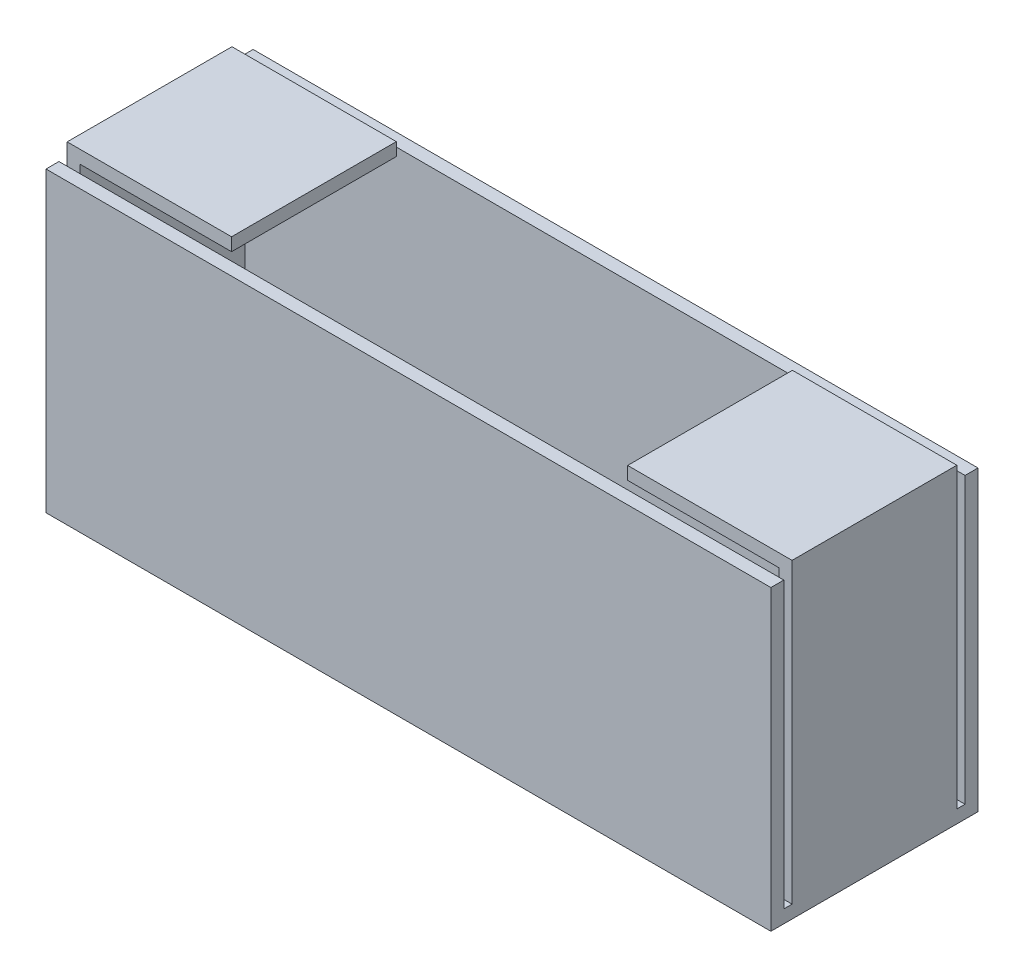
from build123d import *

# Parameters (mm, degrees)
SKETCH1_W           = 56
SKETCH1_H           = 16
BOSS_EXTRUDE1_DEPTH = 1
BOSS_EXTRUDE2_DEPTH = 22
SKETCH3_W           = 1
SKETCH3_H           = 12.73
BOSS_EXTRUDE3_DEPTH = 22
SKETCH4_W           = 12.7
SKETCH4_H           = 12.73
BOSS_EXTRUDE4_DEPTH = 1


with BuildPart() as part:
    # Sketch1 → Boss-Extrude1 (new body)
    with BuildSketch(Plane(origin=(0, 0, 0), x_dir=(1, 0, 0), z_dir=(0, 1, 0))):
        Rectangle(SKETCH1_W, SKETCH1_H)
    extrude(amount=BOSS_EXTRUDE1_DEPTH)

    # Sketch2 → Boss-Extrude2 (add)
    with BuildSketch(Plane(origin=(0, 1, 0), x_dir=(1, 0, 0), z_dir=(0, 1, 0))):
        Polygon((28, -7), (27, -7), (-27, -7), (-28, -7), (-28, -8), (28, -8), align=None)
        Polygon((-27, 7), (27, 7), (28, 7), (28, 8), (-28, 8), (-28, 7), align=None)
    extrude(amount=BOSS_EXTRUDE2_DEPTH)

    # Sketch3 → Boss-Extrude3 (add)
    with BuildSketch(Plane(origin=(0, 1, 0), x_dir=(1, 0, 0), z_dir=(0, 1, 0))):
        with Locations((27.5, 0)):
            Rectangle(SKETCH3_W, SKETCH3_H)
        with Locations((-27.5, 0)):
            Rectangle(SKETCH3_W, SKETCH3_H)
    extrude(amount=BOSS_EXTRUDE3_DEPTH)

    # Sketch4 → Boss-Extrude4 (add)
    with BuildSketch(Plane(origin=(0, 23, 0), x_dir=(1, 0, 0), z_dir=(0, 1, 0))):
        with Locations((-21.65, 0)):
            Rectangle(SKETCH4_W, SKETCH4_H)
        with Locations((21.65, 0)):
            Rectangle(SKETCH4_W, SKETCH4_H)
    extrude(amount=BOSS_EXTRUDE4_DEPTH)


solid = part.part
